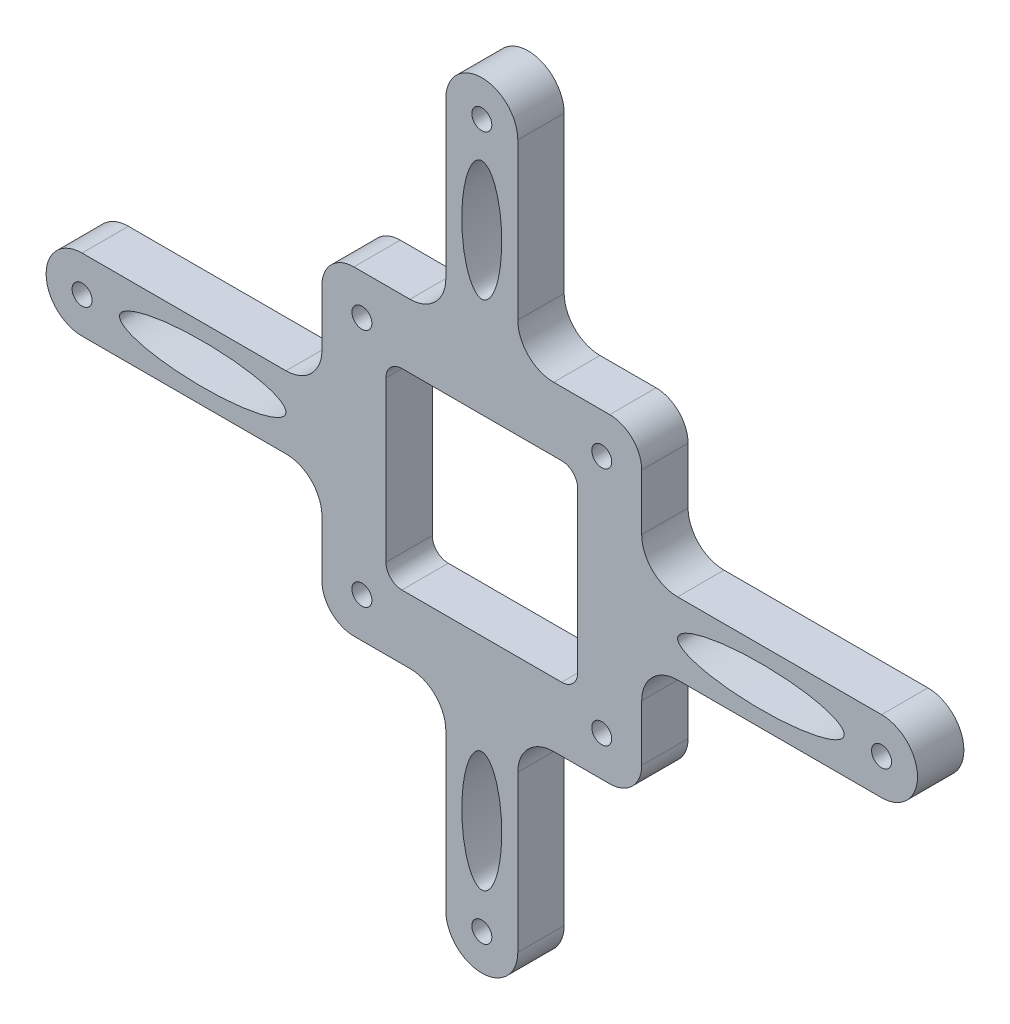
from build123d import *

# Parameters (mm, degrees)
SKETCH1_R           = 1.25
SKETCH1_RX          = 7.495001668
SKETCH1_RY          = 2.505000234
SKETCH1_RX_2        = 10.410152117
SKETCH1_RY_2        = 2.505
BOSS_EXTRUDE1_DEPTH = 5.8


with BuildPart() as part:
    # Sketch1 → Boss-Extrude1 (new body)
    with BuildSketch(Plane.XY):
        with BuildLine():
            Line((-16, 20), (-8.99, 20))
            ThreePointArc((-8.99, 20), (-5.815090552, 21.315090552), (-4.5, 24.49))
            Line((-4.5, 24.49), (-4.5, 44))
            ThreePointArc((-4.5, 44), (-3.181980515, 47.181980515), (0, 48.5))
            ThreePointArc((0, 48.5), (3.181980515, 47.181980515), (4.5, 44))
            Line((4.5, 44), (4.5, 24.49))
            ThreePointArc((4.5, 24.49), (5.815090552, 21.315090552), (8.99, 20))
            Line((8.99, 20), (16, 20))
            ThreePointArc((16, 20), (18.828427125, 18.828427125), (20, 16))
            Line((20, 16), (20, 8.99))
            ThreePointArc((20, 8.99), (21.315090552, 5.815090552), (24.49, 4.5))
            Line((24.49, 4.5), (50, 4.5))
            ThreePointArc((50, 4.5), (54.5, 0), (50, -4.5))
            Line((50, -4.5), (24.49, -4.5))
            ThreePointArc((24.49, -4.5), (21.315090552, -5.815090552), (20, -8.99))
            Line((20, -8.99), (20, -16))
            ThreePointArc((20, -16), (18.828427125, -18.828427125), (16, -20))
            Line((16, -20), (8.99, -20))
            ThreePointArc((8.99, -20), (5.815090552, -21.315090552), (4.5, -24.49))
            Line((4.5, -24.49), (4.5, -44))
            ThreePointArc((4.5, -44), (3.181980515, -47.181980515), (0, -48.5))
            ThreePointArc((0, -48.5), (-3.181980515, -47.181980515), (-4.5, -44))
            Line((-4.5, -44), (-4.5, -24.49))
            ThreePointArc((-4.5, -24.49), (-5.815090552, -21.315090552), (-8.99, -20))
            Line((-8.99, -20), (-16, -20))
            ThreePointArc((-16, -20), (-18.828427125, -18.828427125), (-20, -16))
            Line((-20, -16), (-20, -8.99))
            ThreePointArc((-20, -8.99), (-21.315090552, -5.815090552), (-24.49, -4.5))
            Line((-24.49, -4.5), (-50, -4.5))
            ThreePointArc((-50, -4.5), (-54.5, 0), (-50, 4.5))
            Line((-50, 4.5), (-24.49, 4.5))
            ThreePointArc((-24.49, 4.5), (-21.315090552, 5.815090552), (-20, 8.99))
            Line((-20, 8.99), (-20, 16))
            ThreePointArc((-20, 16), (-18.828427125, 18.828427125), (-16, 20))
        make_face()
        with Locations((0, 44)):
            Circle(SKETCH1_R, mode=Mode.SUBTRACT)
        with Locations((-15, 15)):
            Circle(SKETCH1_R, mode=Mode.SUBTRACT)
        with Locations(Location((15, 15, 0), (0, 0, 180))):
            Circle(SKETCH1_R, mode=Mode.SUBTRACT)
        with Locations((15, -15)):
            Circle(SKETCH1_R, mode=Mode.SUBTRACT)
        with Locations(Location((-15, -15, 0), (0, 0, 180))):
            Circle(SKETCH1_R, mode=Mode.SUBTRACT)
        with Locations((-50, 0)):
            Circle(SKETCH1_R, mode=Mode.SUBTRACT)
        with Locations(Location((50, 0, 0), (0, 0, 180))):
            Circle(SKETCH1_R, mode=Mode.SUBTRACT)
        with Locations(Location((0, -44, 0), (0, 0, 180))):
            Circle(SKETCH1_R, mode=Mode.SUBTRACT)
        with Locations(Location((-0.004999676, 32.005), (0, 0, 89.961779812))):
            Ellipse(SKETCH1_RX, SKETCH1_RY, mode=Mode.SUBTRACT)
        with Locations(Location((-0.004999676, -32.005), (0, 0, -89.961779812))):
            Ellipse(SKETCH1_RX, SKETCH1_RY, mode=Mode.SUBTRACT)
        with Locations(Location((-34.90982111, 0.001514413), (0, 0, 0.005750064))):
            Ellipse(SKETCH1_RX_2, SKETCH1_RY_2, mode=Mode.SUBTRACT)
        with Locations(Location((34.90982111, 0.001514413), (0, 0, 179.994249936))):
            Ellipse(SKETCH1_RX_2, SKETCH1_RY_2, mode=Mode.SUBTRACT)
        with BuildLine():
            Line((9.99479618, -11.99479618), (-9.99479618, -11.99479618))
            ThreePointArc((-9.99479618, -11.99479618), (-11.409009742, -11.409009742), (-11.99479618, -9.99479618))
            Line((-11.99479618, -9.99479618), (-11.99479618, 9.99479618))
            ThreePointArc((-11.99479618, 9.99479618), (-11.409009742, 11.409009742), (-9.99479618, 11.99479618))
            Line((-9.99479618, 11.99479618), (9.99479618, 11.99479618))
            ThreePointArc((9.99479618, 11.99479618), (11.409009742, 11.409009742), (11.99479618, 9.99479618))
            Line((11.99479618, 9.99479618), (11.99479618, -9.99479618))
            ThreePointArc((11.99479618, -9.99479618), (11.409009742, -11.409009742), (9.99479618, -11.99479618))
        make_face(mode=Mode.SUBTRACT)
    extrude(amount=BOSS_EXTRUDE1_DEPTH)


solid = part.part
